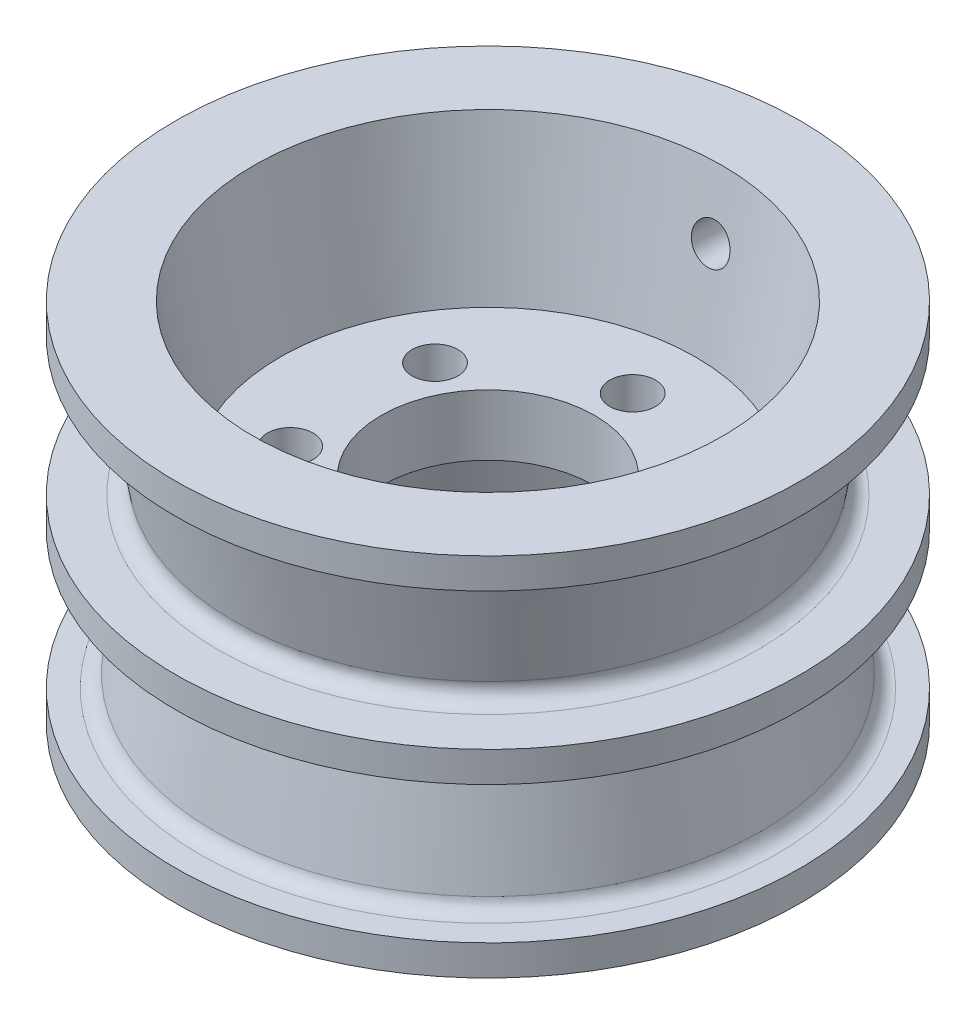
from build123d import *

# Parameters (mm, degrees)
FILLET_1_R               = 1
SKETCH_3_R               = 7
CUT_EXTRUDE_1_DEPTH      = 10
SKETCH_5_R               = 1.25
CUT_EXTRUDE_2_DEPTH      = 24
SKETCH_6_R               = 1.505
CUT_EXTRUDE_3_DEPTH      = 10
PATTERN_CIRCULAR_1_COUNT = 6


with BuildPart() as part:
    # 草图2 → 旋转1 (revolve)
    with BuildSketch(Plane(origin=(0, 0, 0), x_dir=(0, 0, -1), z_dir=(1, 0, 0))):
        Polygon((20.5, 12), (20.5, 10), (18.086942826, 10), (16.5, 1), (20.5, 1), (20.5, -1), (16.5, -1), (18.086942826, -10), (20.5, -10), (20.5, -12), (15.393316952, -12), (13.630047145, -2), (0, -2), (0, 2), (13.630047145, 2), (15.393316952, 12), align=None)
    revolve(axis=Axis((0, -2, 0), (0, 1, 0)))

    # 圆角1
    fillet_1_edges = [part.edges().sort_by_distance(p)[0] for p in [
        (0, -10, 18.086942826),
        (0, -1, 16.5),
        (0, 1, 16.5),
        (0, 10, 18.086942826),
    ]]
    fillet(fillet_1_edges, radius=FILLET_1_R)

    # 草图3 → 切除-拉伸1 (cut)
    with BuildSketch(Plane(origin=(0, 2, 0), x_dir=(1, 0, 0), z_dir=(0, 1, 0))):
        with Locations(Location((0, 0, 0), (0, 0, 270))):
            Circle(SKETCH_3_R)
    extrude(amount=-CUT_EXTRUDE_1_DEPTH, mode=Mode.SUBTRACT)

    # 草图5 → 切除-拉伸2 (cut)
    with BuildSketch(Plane.XY):
        with Locations(Location((0, 7.923648178, 0), (0, 0, 90.000000002))):
            Circle(SKETCH_5_R)
    cut_extrude_2 = extrude(amount=-CUT_EXTRUDE_2_DEPTH, mode=Mode.SUBTRACT)

    # 镜向1: 切除-拉伸2 across plane
    add(cut_extrude_2.mirror(Plane.ZX), mode=Mode.SUBTRACT)

    # 草图6 → 切除-拉伸3 (cut)
    with BuildSketch(Plane.XZ.offset(2)):
        with Locations(Location((0, 9.5, 0), (0, 0, 270))):
            Circle(SKETCH_6_R)
    cut_extrude_3 = extrude(amount=-CUT_EXTRUDE_3_DEPTH, mode=Mode.SUBTRACT)

    # 阵列(圆周)1: 切除-拉伸3 ×6 about axis
    pattern_circular_1_axis = Axis((0, 0, 0), (0, 1, 0))
    for i in range(1, PATTERN_CIRCULAR_1_COUNT):
        add(cut_extrude_3.rotate(pattern_circular_1_axis, i * 360 / PATTERN_CIRCULAR_1_COUNT), mode=Mode.SUBTRACT)


solid = part.part
